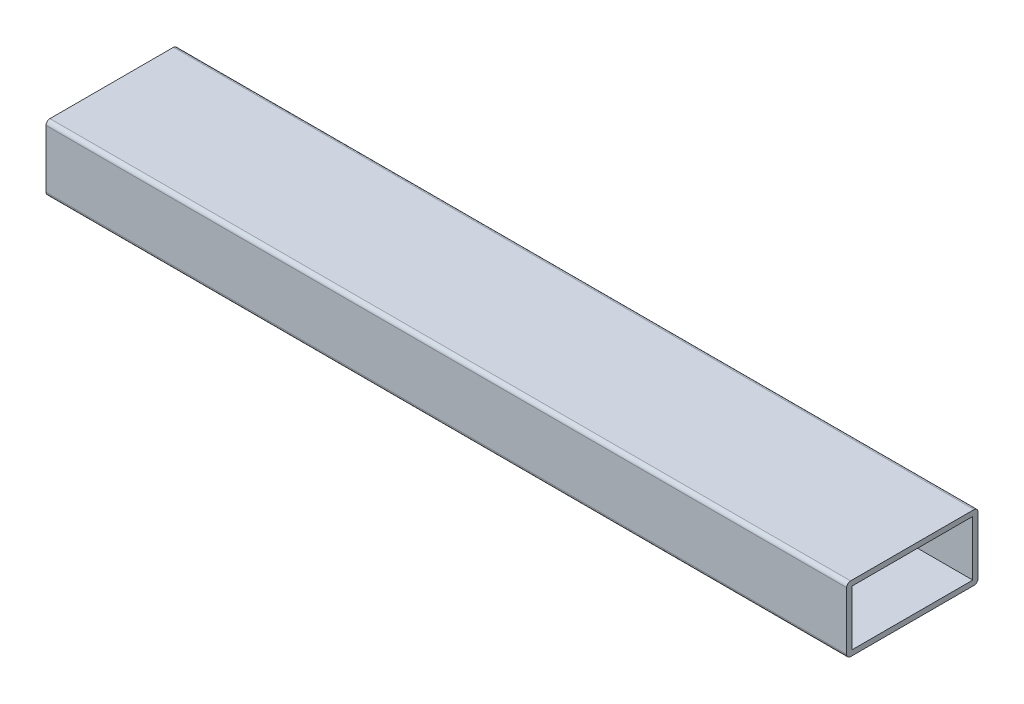
from build123d import *

# Parameters (mm, degrees)
BOSS_EXTRUDE1_DEPTH = 152.4
SHELL1_T            = -2


with BuildPart() as part:
    # Sketch1 → Boss-Extrude1 (new, symmetric)
    with BuildSketch(Plane(origin=(0, 0, 0), x_dir=(0, 0, -1), z_dir=(1, 0, 0))):
        with BuildLine():
            Line((-23.5, 12.5), (23.5, 12.5))
            ThreePointArc((23.5, 12.5), (24.560660172, 12.060660172), (25, 11))
            Line((25, 11), (25, -11))
            ThreePointArc((25, -11), (24.560660172, -12.060660172), (23.5, -12.5))
            Line((23.5, -12.5), (-23.5, -12.5))
            ThreePointArc((-23.5, -12.5), (-24.560660172, -12.060660172), (-25, -11))
            Line((-25, -11), (-25, 11))
            ThreePointArc((-25, 11), (-24.560660172, 12.060660172), (-23.5, 12.5))
        make_face()
    extrude(amount=BOSS_EXTRUDE1_DEPTH, both=True)

    # Shell1
    shell1_openings = [part.faces().sort_by_distance(p)[0] for p in [
        (152.4, 0, 0),
        (-152.4, 0, 0),
    ]]
    offset(amount=SHELL1_T, openings=shell1_openings, kind=Kind.INTERSECTION)


solid = part.part
